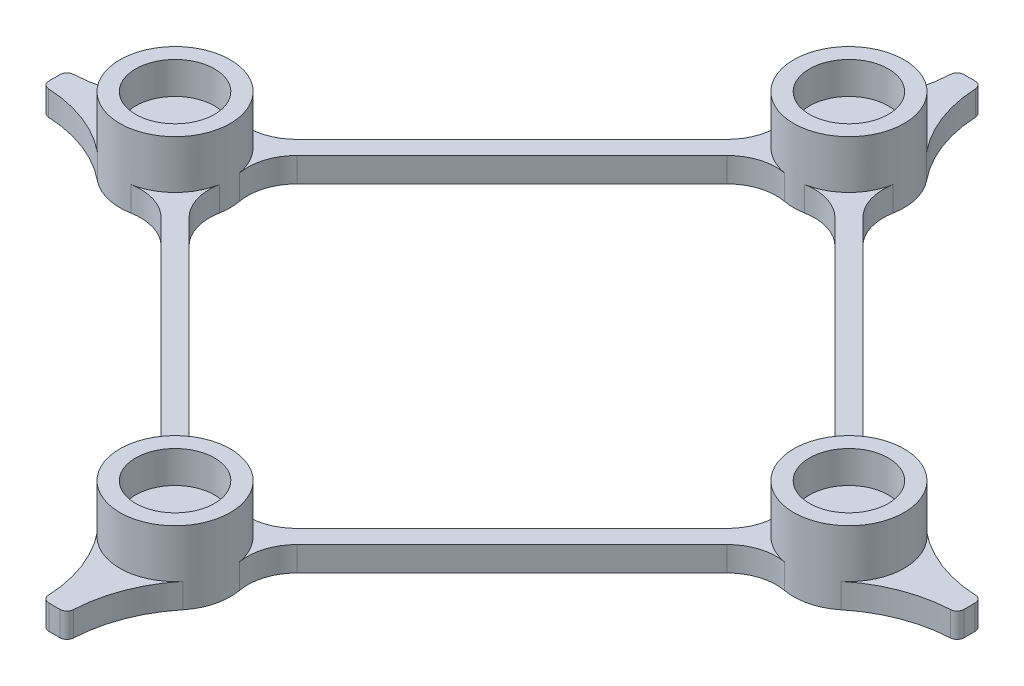
from build123d import *
from build123d.topology import SkipClean

# Parameters (mm, degrees)
SKETCH1_R           = 8
BOSS_EXTRUDE1_DEPTH = 5
FILLET1_R           = 10
FILLET2_R           = 1.4
SKETCH2_R           = 11.2
SKETCH2_R_2         = 8
BOSS_EXTRUDE2_DEPTH = 8.3
BOSS_EXTRUDE3_START = 8.3
SKETCH2_3_R         = 11.2
SKETCH2_3_R_2       = 8
BOSS_EXTRUDE3_DEPTH = 6.5


with BuildPart() as part:
    # Sketch1 → Boss-Extrude1 (new body)
    # profile 1 of 5: a face of its own
    with BuildSketch(Plane(origin=(0, 0, 0), x_dir=(1, 0, 0), z_dir=(0, 1, 0))):
        with BuildLine():
            ThreePointArc((-92.766319319, -2.5), (-92.8, 0), (-92.766319319, 2.5))
            ThreePointArc((-92.766319319, 2.5), (-83.552209715, 4.091192278), (-75.405408011, 8.680454818))
            ThreePointArc((-75.405408011, 8.680454818), (-68.765546316, 11.191450005), (-61.949909667, 9.206517458))
            Line((-61.949909667, 9.206517458), (-9.206517458, 61.949909667))
            ThreePointArc((-9.206517458, 61.949909667), (-11.191450005, 68.765546316), (-8.680454818, 75.405408011))
            ThreePointArc((-8.680454818, 75.405408011), (-4.091192278, 83.552209715), (-2.5, 92.766319319))
            ThreePointArc((-2.5, 92.766319319), (0, 92.8), (2.5, 92.766319319))
            ThreePointArc((2.5, 92.766319319), (4.091192278, 83.552209715), (8.680454818, 75.405408011))
            ThreePointArc((8.680454818, 75.405408011), (11.191450005, 68.765546316), (9.206517458, 61.949909667))
            Line((9.206517458, 61.949909667), (61.949909667, 9.206517458))
            ThreePointArc((61.949909667, 9.206517458), (68.765546316, 11.191450005), (75.405408011, 8.680454818))
            ThreePointArc((75.405408011, 8.680454818), (83.552209715, 4.091192278), (92.766319319, 2.5))
            ThreePointArc((92.766319319, 2.5), (92.8, 0), (92.766319319, -2.5))
            ThreePointArc((92.766319319, -2.5), (83.552209715, -4.091192278), (75.405408011, -8.680454818))
            ThreePointArc((75.405408011, -8.680454818), (68.765546316, -11.191450005), (61.949909667, -9.206517458))
            Line((61.949909667, -9.206517458), (9.206517458, -61.949909667))
            ThreePointArc((9.206517458, -61.949909667), (11.191450005, -68.765546316), (8.680454818, -75.405408011))
            ThreePointArc((8.680454818, -75.405408011), (4.091192278, -83.552209715), (2.5, -92.766319319))
            ThreePointArc((2.5, -92.766319319), (0, -92.8), (-2.5, -92.766319319))
            ThreePointArc((-2.5, -92.766319319), (-4.091192278, -83.552209715), (-8.680454818, -75.405408011))
            ThreePointArc((-8.680454818, -75.405408011), (-11.191450005, -68.765546316), (-9.206517458, -61.949909667))
            Line((-9.206517458, -61.949909667), (-61.949909667, -9.206517458))
            ThreePointArc((-61.949909667, -9.206517458), (-68.765546316, -11.191450005), (-75.405408011, -8.680454818))
            ThreePointArc((-75.405408011, -8.680454818), (-83.552209715, -4.091192278), (-92.766319319, -2.5))
        make_face()
        with Locations((-68.328, 0)):
            Circle(SKETCH1_R, mode=Mode.SUBTRACT)
        with Locations((0, -68.328)):
            Circle(SKETCH1_R, mode=Mode.SUBTRACT)
        with Locations((68.328, 0)):
            Circle(SKETCH1_R, mode=Mode.SUBTRACT)
        with Locations((0, 68.328)):
            Circle(SKETCH1_R, mode=Mode.SUBTRACT)
        with BuildLine():
            Line((-59.121482542, -6.378090333), (-6.378090333, -59.121482542))
            ThreePointArc((-6.378090333, -59.121482542), (0, -57.128), (6.378090333, -59.121482542))
            Line((6.378090333, -59.121482542), (59.121482542, -6.378090333))
            ThreePointArc((59.121482542, -6.378090333), (57.128, 0), (59.121482542, 6.378090333))
            Line((59.121482542, 6.378090333), (6.378090333, 59.121482542))
            ThreePointArc((6.378090333, 59.121482542), (0, 57.128), (-6.378090333, 59.121482542))
            Line((-6.378090333, 59.121482542), (-59.121482542, 6.378090333))
            ThreePointArc((-59.121482542, 6.378090333), (-57.128, 0), (-59.121482542, -6.378090333))
        make_face(mode=Mode.SUBTRACT)
    # profile 2 of 5: a face of its own
    with BuildSketch(Plane(origin=(0, 0, 0), x_dir=(1, 0, 0), z_dir=(0, 1, 0))):
        with Locations((-68.328, 0)):
            Circle(SKETCH1_R)
    # profile 3 of 5: a face of its own
    with BuildSketch(Plane(origin=(0, 0, 0), x_dir=(1, 0, 0), z_dir=(0, 1, 0))):
        with Locations((0, -68.328)):
            Circle(SKETCH1_R)
    # profile 4 of 5: a face of its own
    with BuildSketch(Plane(origin=(0, 0, 0), x_dir=(1, 0, 0), z_dir=(0, 1, 0))):
        with Locations((68.328, 0)):
            Circle(SKETCH1_R)
    # profile 5 of 5: a face of its own
    with BuildSketch(Plane(origin=(0, 0, 0), x_dir=(1, 0, 0), z_dir=(0, 1, 0))):
        with Locations((0, 68.328)):
            Circle(SKETCH1_R)
    extrude(amount=BOSS_EXTRUDE1_DEPTH)

    # Fillet1
    fillet1_edges = [part.edges().sort_by_distance(p)[0] for p in [
        (-6.378090333, 2.5, 59.121482542),
        (6.378090333, 2.5, 59.121482542),
        (59.121482542, 2.5, 6.378090333),
        (59.121482542, 2.5, -6.378090333),
        (6.378090333, 2.5, -59.121482542),
        (-6.378090333, 2.5, -59.121482542),
        (-59.121482542, 2.5, -6.378090333),
        (-59.121482542, 2.5, 6.378090333),
        (-61.949909667, 2.5, -9.206517458),
        (-9.206517458, 2.5, -61.949909667),
        (9.206517458, 2.5, -61.949909667),
        (61.949909667, 2.5, -9.206517458),
        (61.949909667, 2.5, 9.206517458),
        (9.206517458, 2.5, 61.949909667),
        (-9.206517458, 2.5, 61.949909667),
        (-61.949909667, 2.5, 9.206517458),
    ]]
    fillet(fillet1_edges, radius=FILLET1_R)

    # Fillet2
    fillet2_edges = [part.edges().sort_by_distance(p)[0] for p in [
        (-92.766319319, 2.5, -2.5),
        (-2.5, 2.5, -92.766319319),
        (2.5, 2.5, -92.766319319),
        (92.766319319, 2.5, -2.5),
        (92.766319319, 2.5, 2.5),
        (2.5, 2.5, 92.766319319),
        (-2.5, 2.5, 92.766319319),
        (-92.766319319, 2.5, 2.5),
    ]]
    fillet(fillet2_edges, radius=FILLET2_R)

    # Sketch2 → Boss-Extrude2 (add)
    # profile 1 of 8: a face of its own
    with SkipClean():  # the faces are left unmerged after this step: merging them gives an invalid solid
        with BuildSketch(Plane(origin=(0, 0, 0), x_dir=(1, 0, 0), z_dir=(0, 1, 0))):
            with Locations(Location((-68.328, 0, 0), (0, 0, 79.47438461))):
                Circle(SKETCH2_R)
            with Locations((-68.328, 0)):
                Circle(SKETCH2_R_2, mode=Mode.SUBTRACT)
        # profile 2 of 8: a face of its own
        with BuildSketch(Plane(origin=(0, 0, 0), x_dir=(1, 0, 0), z_dir=(0, 1, 0))):
            with Locations((-68.328, 0)):
                Circle(SKETCH2_R_2)
        # profile 3 of 8: a face of its own
        with BuildSketch(Plane(origin=(0, 0, 0), x_dir=(1, 0, 0), z_dir=(0, 1, 0))):
            with Locations(Location((0, 68.328, 0), (0, 0, 140.808714449))):
                Circle(SKETCH2_R)
            with Locations((0, 68.328)):
                Circle(SKETCH2_R_2, mode=Mode.SUBTRACT)
        # profile 4 of 8: a face of its own
        with BuildSketch(Plane(origin=(0, 0, 0), x_dir=(1, 0, 0), z_dir=(0, 1, 0))):
            with Locations((0, 68.328)):
                Circle(SKETCH2_R_2)
        # profile 5 of 8: a face of its own
        with BuildSketch(Plane(origin=(0, 0, 0), x_dir=(1, 0, 0), z_dir=(0, 1, 0))):
            with Locations(Location((68.328, 0, 0), (0, 0, 100.52561539))):
                Circle(SKETCH2_R)
            with Locations((68.328, 0)):
                Circle(SKETCH2_R_2, mode=Mode.SUBTRACT)
        # profile 6 of 8: a face of its own
        with BuildSketch(Plane(origin=(0, 0, 0), x_dir=(1, 0, 0), z_dir=(0, 1, 0))):
            with Locations((68.328, 0)):
                Circle(SKETCH2_R_2)
        # profile 7 of 8: a face of its own
        with BuildSketch(Plane(origin=(0, 0, 0), x_dir=(1, 0, 0), z_dir=(0, 1, 0))):
            with Locations(Location((0, -68.328, 0), (0, 0, 100.52561539))):
                Circle(SKETCH2_R)
            with Locations((0, -68.328)):
                Circle(SKETCH2_R_2, mode=Mode.SUBTRACT)
        # profile 8 of 8: a face of its own
        with BuildSketch(Plane(origin=(0, 0, 0), x_dir=(1, 0, 0), z_dir=(0, 1, 0))):
            with Locations((0, -68.328)):
                Circle(SKETCH2_R_2)
        extrude(amount=BOSS_EXTRUDE2_DEPTH)

    # Sketch2<3> → Boss-Extrude3 (add)
    # profile 1 of 4: a face of its own
    with SkipClean():  # the faces are left unmerged after this step: merging them gives an invalid solid
        with BuildSketch(Plane(origin=(0, 0, 0), x_dir=(1, 0, 0), z_dir=(0, 1, 0)).offset(BOSS_EXTRUDE3_START)):
            with Locations(Location((-68.328, 0, 0), (0, 0, 79.47438461))):
                Circle(SKETCH2_3_R)
            with Locations(Location((-68.328, 0, 0), (0, 0, 90))):
                Circle(SKETCH2_3_R_2, mode=Mode.SUBTRACT)
        # profile 2 of 4: a face of its own
        with BuildSketch(Plane(origin=(0, 0, 0), x_dir=(1, 0, 0), z_dir=(0, 1, 0)).offset(BOSS_EXTRUDE3_START)):
            with Locations(Location((0, 68.328, 0), (0, 0, 140.808714449))):
                Circle(SKETCH2_3_R)
            with Locations(Location((0, 68.328, 0), (0, 0, 90))):
                Circle(SKETCH2_3_R_2, mode=Mode.SUBTRACT)
        # profile 3 of 4: a face of its own
        with BuildSketch(Plane(origin=(0, 0, 0), x_dir=(1, 0, 0), z_dir=(0, 1, 0)).offset(BOSS_EXTRUDE3_START)):
            with Locations(Location((68.328, 0, 0), (0, 0, 100.52561539))):
                Circle(SKETCH2_3_R)
            with Locations(Location((68.328, 0, 0), (0, 0, 90))):
                Circle(SKETCH2_3_R_2, mode=Mode.SUBTRACT)
        # profile 4 of 4: a face of its own
        with BuildSketch(Plane(origin=(0, 0, 0), x_dir=(1, 0, 0), z_dir=(0, 1, 0)).offset(BOSS_EXTRUDE3_START)):
            with Locations(Location((0, -68.328, 0), (0, 0, 100.52561539))):
                Circle(SKETCH2_3_R)
            with Locations(Location((0, -68.328, 0), (0, 0, 90))):
                Circle(SKETCH2_3_R_2, mode=Mode.SUBTRACT)
        extrude(amount=BOSS_EXTRUDE3_DEPTH)


solid = part.part
